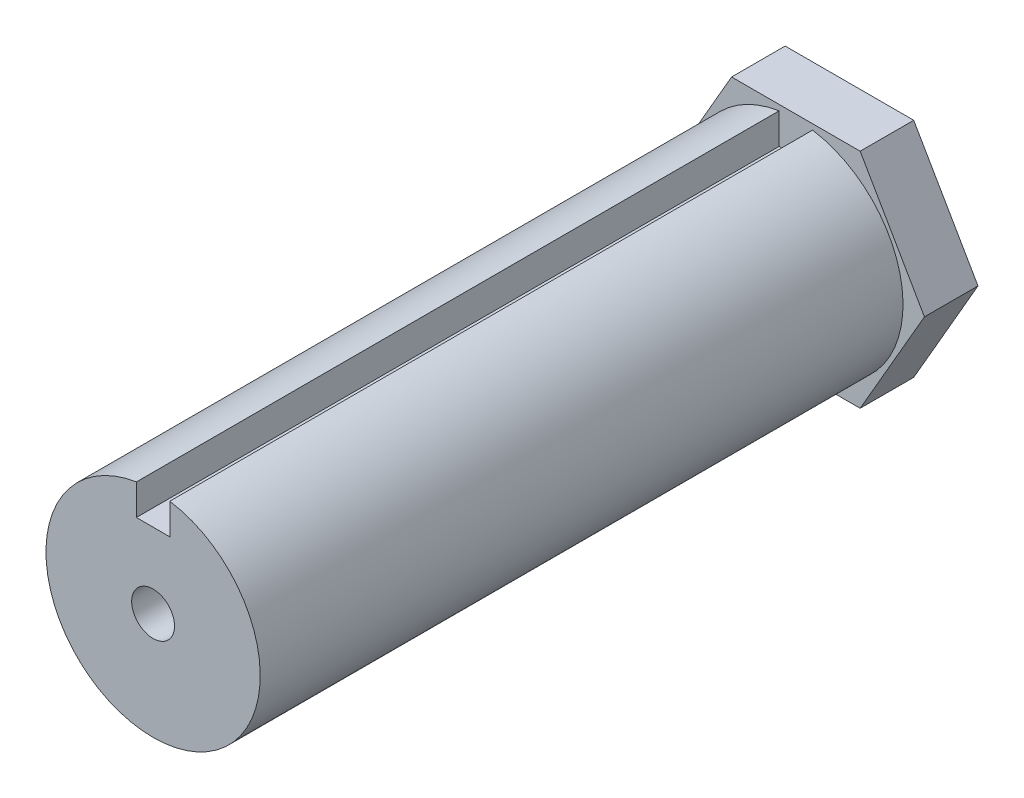
from build123d import *

# Parameters (mm, degrees)
BOSS_EXTRUDE3_DEPTH = 5
SKETCH5_R           = 10
BOSS_EXTRUDE4_DEPTH = 60
SKETCH6_R           = 2
CUT_EXTRUDE1_DEPTH  = 20
SKETCH9_W           = 3.11933689
SKETCH9_H           = 7.065160472
CUT_EXTRUDE3_DEPTH  = 60


with BuildPart() as part:
    # Sketch3 → Boss-Extrude3 (new body)
    with BuildSketch(Plane.XY):
        Polygon((6, 10.392304845), (-6, 10.392304845), (-12, 0), (-6, -10.392304845), (6, -10.392304845), (12, 0), align=None)
    extrude(amount=BOSS_EXTRUDE3_DEPTH)

    # Sketch5 → Boss-Extrude4 (add)
    with BuildSketch(Plane.XY.offset(5)):
        Circle(SKETCH5_R)
    extrude(amount=BOSS_EXTRUDE4_DEPTH)

    # Sketch6 → Cut-Extrude1 (cut)
    with BuildSketch(Plane.XY.offset(65)):
        Circle(SKETCH6_R)
    extrude(amount=-CUT_EXTRUDE1_DEPTH, mode=Mode.SUBTRACT)

    # Sketch9 → Cut-Extrude3 (cut)
    with BuildSketch(Plane.XY.offset(65)):
        with Locations((0, 10.532580236)):
            Rectangle(SKETCH9_W, SKETCH9_H)
    extrude(amount=-CUT_EXTRUDE3_DEPTH, mode=Mode.SUBTRACT)


solid = part.part
